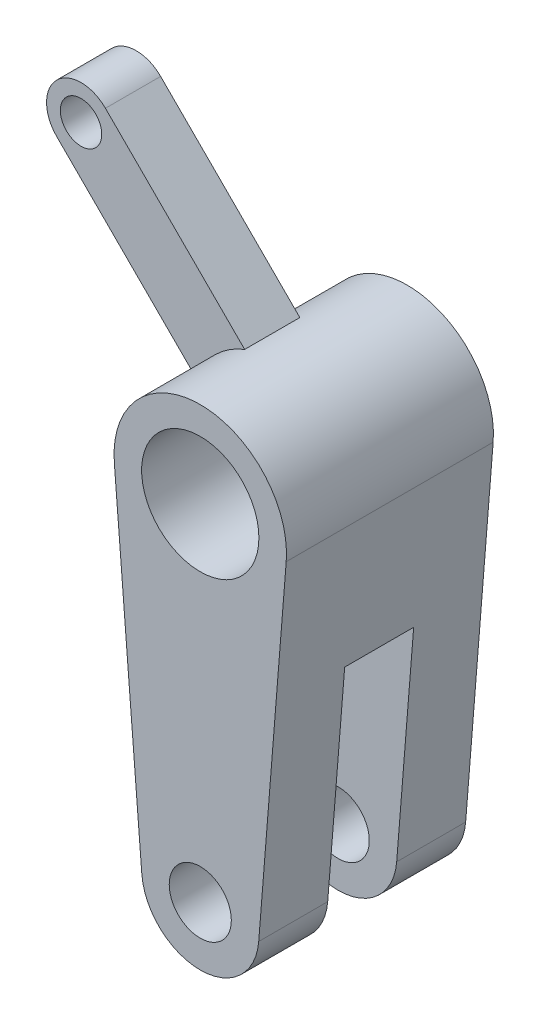
from build123d import *

# Parameters (mm, degrees)
SKETCH_1_R          = 8.5
SKETCH_1_R_2        = 4.5
EXTRUDE_1_DEPTH     = 15
SKETCH_2_W          = 30
SKETCH_2_H          = 60
CUT_EXTRUDE_1_DEPTH = 5
SKETCH_3_R          = 3
EXTRUDE_2_DEPTH     = 4


with BuildPart() as part:
    # Эскиз1 → Бобышка-Вытянуть1 (new, symmetric)
    with BuildSketch(Plane.XY):
        with BuildLine():
            ThreePointArc((12.459935794, -1), (0, 12.5), (-12.459935794, -1))
            Line((-12.459935794, -1), (-8.47275634, -50.68))
            ThreePointArc((-8.47275634, -50.68), (0, -58.5), (8.47275634, -50.68))
            Line((8.47275634, -50.68), (12.459935794, -1))
        make_face()
        Circle(SKETCH_1_R, mode=Mode.SUBTRACT)
        with Locations((0, -50)):
            Circle(SKETCH_1_R_2, mode=Mode.SUBTRACT)
    extrude(amount=EXTRUDE_1_DEPTH, both=True)

    # Эскиз2 → Вырез-Вытянуть1 (cut, symmetric)
    with BuildSketch(Plane.XY):
        with Locations((0, -50)):
            Rectangle(SKETCH_2_W, SKETCH_2_H)
    extrude(amount=CUT_EXTRUDE_1_DEPTH, both=True, mode=Mode.SUBTRACT)

    # Эскиз3 → Бобышка-Вытянуть2 (add, symmetric)
    with BuildSketch(Plane.XY):
        with BuildLine():
            Line((-31.819805153, 24.748737342), (-11.636459779, 4.565391967))
            ThreePointArc((-11.636459779, 4.565391967), (-8.838834765, 8.838834765), (-4.565391967, 11.636459779))
            Line((-4.565391967, 11.636459779), (-24.748737342, 31.819805153))
            ThreePointArc((-24.748737342, 31.819805153), (-31.819805153, 31.819805153), (-31.819805153, 24.748737342))
        make_face()
        with Locations((-28.284271247, 28.284271247)):
            Circle(SKETCH_3_R, mode=Mode.SUBTRACT)
    extrude(amount=EXTRUDE_2_DEPTH, both=True)


solid = part.part
